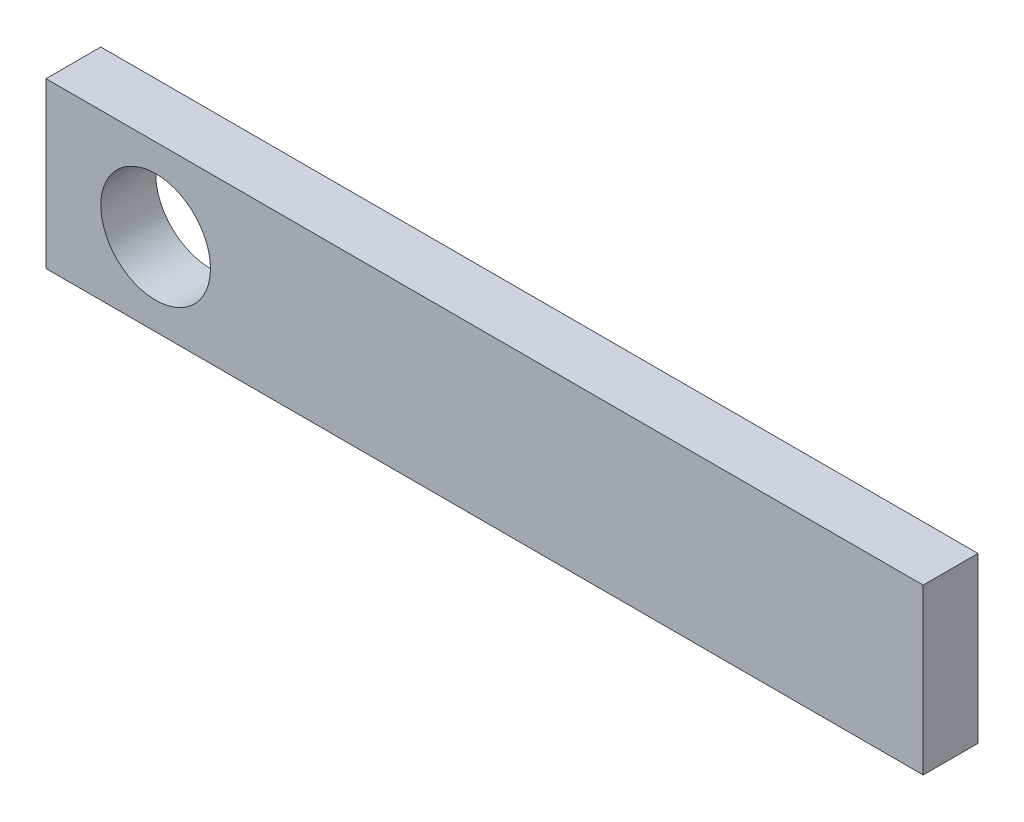
from build123d import *

# Parameters (mm, degrees)
CRANK_ARM_PROFILE_W  = 160
CRANK_ARM_PROFILE_H  = 30
CRANK_ARM_PROFILE_R  = 10
CRANK_ARM_10MM_DEPTH = 10


with BuildPart() as part:
    # Crank_Arm_Profile → Crank_Arm_10mm (new body)
    with BuildSketch(Plane.XY):
        with Locations((60, 0)):
            Rectangle(CRANK_ARM_PROFILE_W, CRANK_ARM_PROFILE_H)
        Circle(CRANK_ARM_PROFILE_R, mode=Mode.SUBTRACT)
    extrude(amount=CRANK_ARM_10MM_DEPTH)


solid = part.part
